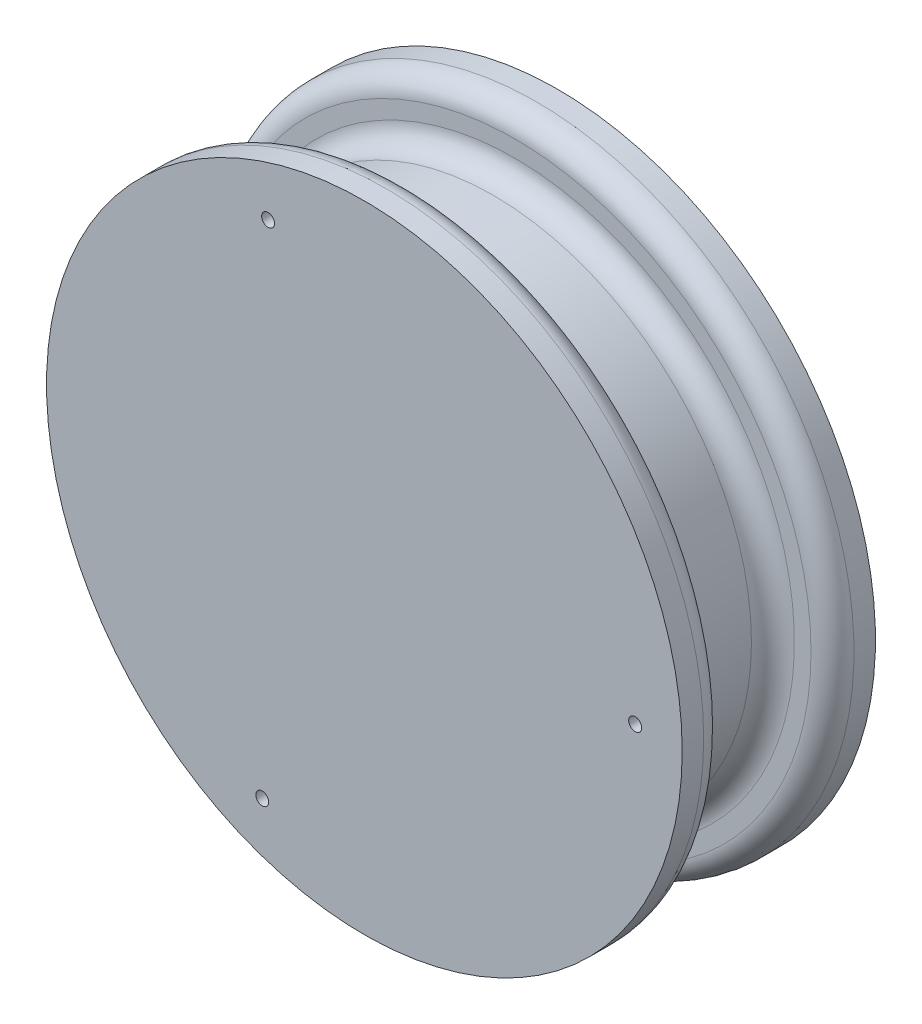
from build123d import *

# Parameters (mm, degrees)
SKETCH1_R           = 14.799242092
BOSS_EXTRUDE1_DEPTH = 2
SKETCH2_R           = 12.023378779
BOSS_EXTRUDE2_DEPTH = 5
SKETCH3_R           = 14.798614579
BOSS_EXTRUDE3_DEPTH = 2
SKETCH4_R           = 6.085537025
BOSS_EXTRUDE5_DEPTH = 3.8
FILLET5_R           = 1
FILLET6_R           = 0.5
CUT_EXTRUDE1_DEPTH  = 8.3
SKETCH8_R           = 0.302475122
SKETCH8_R_2         = 0.3
CUT_EXTRUDE3_DEPTH  = 2.3
FILLET7_R           = 1
FILLET8_R           = 1


with BuildPart() as part:
    # Sketch1 → Boss-Extrude1 (new body)
    with BuildSketch(Plane.XY):
        Circle(SKETCH1_R)
    extrude(amount=BOSS_EXTRUDE1_DEPTH)

    # Sketch2 → Boss-Extrude2 (add)
    with BuildSketch(Plane(origin=(0, 0, 0), x_dir=(-1, 0, 0), z_dir=(0, 0, -1))):
        Circle(SKETCH2_R)
    extrude(amount=BOSS_EXTRUDE2_DEPTH)

    # Sketch3 → Boss-Extrude3 (add)
    with BuildSketch(Plane(origin=(0, 0, -5), x_dir=(-1, 0, 0), z_dir=(0, 0, -1))):
        Circle(SKETCH3_R)
    extrude(amount=BOSS_EXTRUDE3_DEPTH)

    # Sketch4 → Boss-Extrude5 (add)
    with BuildSketch(Plane(origin=(0, 0, -7), x_dir=(-1, 0, 0), z_dir=(0, 0, -1))):
        with Locations(Location((0, 0, 0), (0, 0, 180))):
            Circle(SKETCH4_R)
    extrude(amount=BOSS_EXTRUDE5_DEPTH)

    # Fillet5
    fillet5_edges = [part.edges().sort_by_distance(p)[0] for p in [
        (-14.799242092, 0, 0),
    ]]
    fillet(fillet5_edges, radius=FILLET5_R)

    # Fillet6
    fillet6_edges = [part.edges().sort_by_distance(p)[0] for p in [
        (12.023378779, 0, 0),
    ]]
    fillet(fillet6_edges, radius=FILLET6_R)

    # Sketch7 → Cut-Extrude1 (cut)
    with BuildSketch(Plane(origin=(0, 0, -10.8), x_dir=(-1, 0, 0), z_dir=(0, 0, -1))):
        with BuildLine():
            Line((0, -2.3), (-2.503996805, -2.3))
            ThreePointArc((-2.503996805, -2.3), (-3.4, 0), (-2.503996805, 2.3))
            Line((-2.503996805, 2.3), (0, 2.3))
            Line((0, 2.3), (2.503996805, 2.3))
            ThreePointArc((2.503996805, 2.3), (3.4, 0), (2.503996805, -2.3))
            Line((2.503996805, -2.3), (0, -2.3))
        make_face()
    extrude(amount=-CUT_EXTRUDE1_DEPTH, mode=Mode.SUBTRACT)

    # Sketch8 → Cut-Extrude3 (cut)
    with BuildSketch(Plane.XY.offset(2)):
        with Locations((12.610771715, 0)):
            Circle(SKETCH8_R)
        with Locations((-4.484302396, 11.786542974)):
            Circle(SKETCH8_R_2)
        with Locations((-4.755704429, -11.679676307)):
            Circle(SKETCH8_R_2)
    extrude(amount=-CUT_EXTRUDE3_DEPTH, mode=Mode.SUBTRACT)

    # Fillet7
    fillet7_edges = [part.edges().sort_by_distance(p)[0] for p in [
        (12.023378779, 0, -5),
    ]]
    fillet(fillet7_edges, radius=FILLET7_R)

    # Fillet8
    fillet8_edges = [part.edges().sort_by_distance(p)[0] for p in [
        (14.798614579, 0, -5),
    ]]
    fillet(fillet8_edges, radius=FILLET8_R)


solid = part.part
